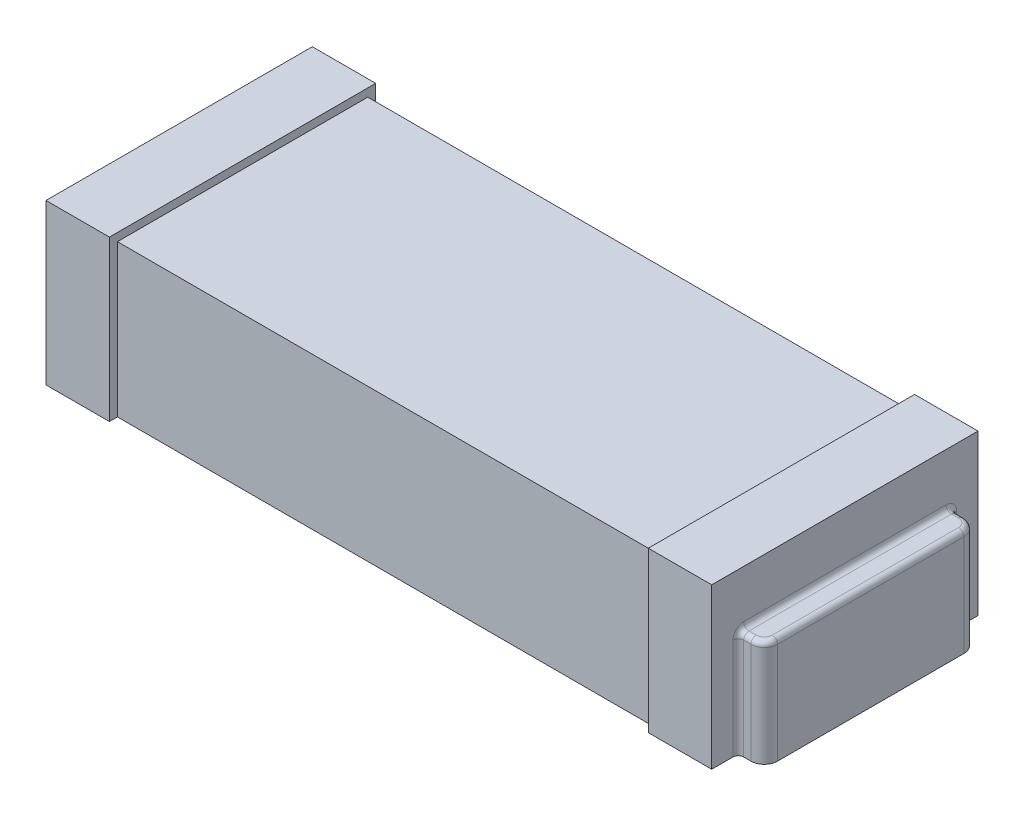
from build123d import *

# Parameters (mm, degrees)
ESQUISSE1_W             = 2.5
ESQUISSE1_H             = 1
BOSS_EXTRU_1_DEPTH      = 0.6
ESQUISSE2_W             = 2.023603034
ESQUISSE2_H             = 1
ENL_V_MAT_EXTRU_1_DEPTH = 0.03
BOSS_EXTRU_2_DEPTH      = 0.4
CONG_1_R                = 0.02
CONG_1_OF_SYM_TRIE2_R   = 0.02
ESQUISSE5_W             = 2.023603034
ESQUISSE5_H             = 0.57
ENL_V_MAT_EXTRU_2_DEPTH = 0.03


with BuildPart() as part:
    # Esquisse1 → Boss.-Extru.1 (new body)
    with BuildSketch(Plane(origin=(0, 0, 0), x_dir=(1, 0, 0), z_dir=(0, 1, 0))):
        Rectangle(ESQUISSE1_W, ESQUISSE1_H)
    extrude(amount=BOSS_EXTRU_1_DEPTH)

    # Esquisse2 → Enlèv. mat.-Extru.1 (cut)
    with BuildSketch(Plane(origin=(0, 0.6, 0), x_dir=(1, 0, 0), z_dir=(0, 1, 0))):
        Rectangle(ESQUISSE2_W, ESQUISSE2_H)
    extrude(amount=-ENL_V_MAT_EXTRU_1_DEPTH, mode=Mode.SUBTRACT)

    # Esquisse3 → Boss.-Extru.2 (add)
    with BuildSketch(Plane(origin=(0, 0, 0), x_dir=(1, 0, 0), z_dir=(0, 1, 0))):
        with BuildLine():
            Line((1.25, 0.4), (1.297141448, 0.4))
            ThreePointArc((1.297141448, 0.4), (1.332496787, 0.385355339), (1.347141448, 0.35))
            Line((1.347141448, 0.35), (1.347141448, -0.35))
            ThreePointArc((1.347141448, -0.35), (1.332496787, -0.385355339), (1.297141448, -0.4))
            Line((1.297141448, -0.4), (1.25, -0.4))
            Line((1.25, -0.4), (1.25, 0.4))
        make_face()
    boss_extru_2 = extrude(amount=BOSS_EXTRU_2_DEPTH)

    # Congé1
    cong_1_edges = [part.edges().sort_by_distance(p)[0] for p in [
        (1.25, 0.2, -0.4),
        (1.25, 0.2, 0.4),
        (1.25, 0.4, 0),
        (1.273570724, 0.4, 0.4),
        (1.332496787, 0.4, 0.385355339),
        (1.347141448, 0.4, 0),
        (1.332496787, 0.4, -0.385355339),
        (1.273570724, 0.4, -0.4),
    ]]
    fillet(cong_1_edges, radius=CONG_1_R)

    # Symétrie2: Boss.-Extru.2 across plane
    add(boss_extru_2.mirror(Plane(origin=(0, 0, 0), x_dir=(0, 0, 1), z_dir=(1, 0, 0))))

    # Congé1 of Symétrie2
    cong_1_of_sym_trie2_edges = [part.edges().sort_by_distance(p)[0] for p in [
        (-1.25, 0.2, -0.4),
        (-1.25, 0.2, 0.4),
        (-1.25, 0.4, 0),
        (-1.273570724, 0.4, 0.4),
        (-1.332496787, 0.4, 0.385355339),
        (-1.347141448, 0.4, 0),
        (-1.332496787, 0.4, -0.385355339),
        (-1.273570724, 0.4, -0.4),
    ]]
    fillet(cong_1_of_sym_trie2_edges, radius=CONG_1_OF_SYM_TRIE2_R)

    # Esquisse5 → Enlèv. mat.-Extru.2 (cut)
    with BuildSketch(Plane(origin=(0, 0, -0.5), x_dir=(-1, 0, 0), z_dir=(0, 0, -1))):
        with Locations((0, 0.285)):
            Rectangle(ESQUISSE5_W, ESQUISSE5_H)
    enl_v_mat_extru_2 = extrude(amount=-ENL_V_MAT_EXTRU_2_DEPTH, mode=Mode.SUBTRACT)

    # Symétrie3: Enlèv. mat.-Extru.2 across plane
    add(enl_v_mat_extru_2.mirror(Plane.XY), mode=Mode.SUBTRACT)


solid = part.part
